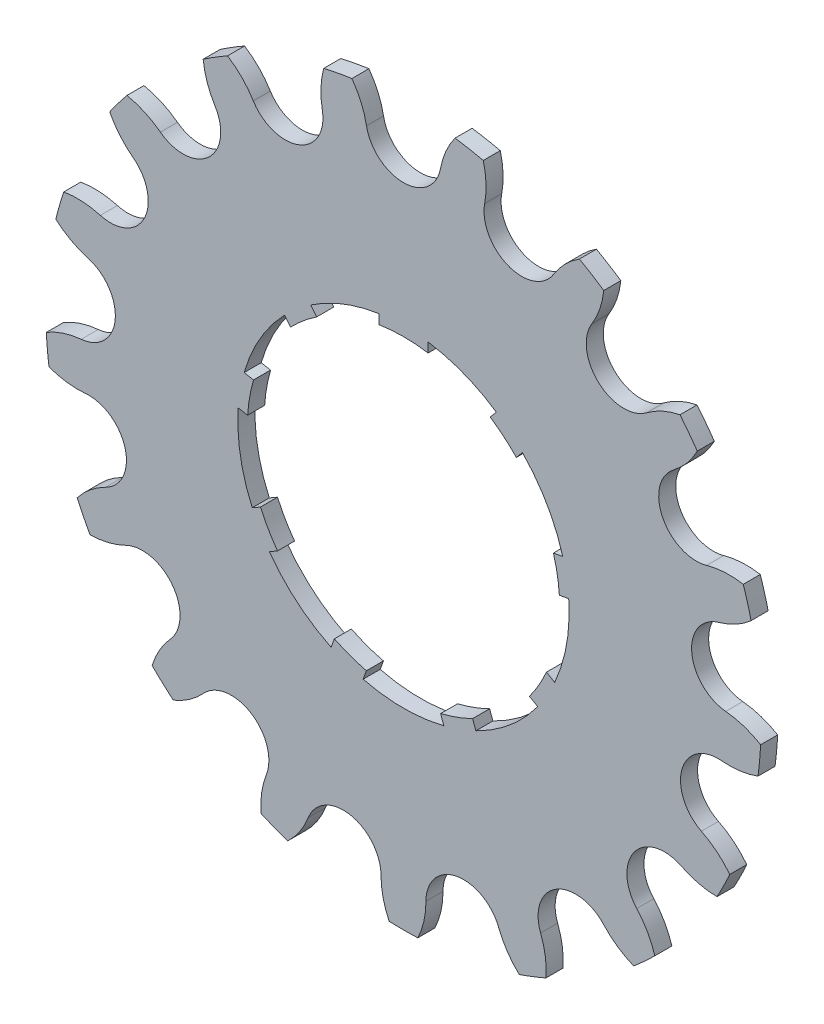
from build123d import *

# Parameters (mm, degrees)
SK_DISCO_R           = 37.77949966
DISCO_DEPTH          = 1.8
HUECO_DIENTE_DEPTH   = 54.458593221
MATRIZ_DIENTES_COUNT = 17


with BuildPart() as part:
    # Sk_Disco → Disco (new body)
    with BuildSketch(Plane.XY):
        Circle(SK_DISCO_R)
        with BuildLine():
            Line((2.6, 17.305779381), (2.6, 16.293863876))
            ThreePointArc((2.6, 16.293863876), (0, 16.5), (-2.6, 16.293863876))
            Line((-2.6, 16.293863876), (-2.6, 17.305779381))
            ThreePointArc((-2.6, 17.305779381), (-6.362648192, 16.302352836), (-9.810241185, 14.491693065))
            Line((-9.810241185, 14.491693065), (-9.163816615, 13.721314261))
            ThreePointArc((-9.163816615, 13.721314261), (-10.60599556, 12.639733311), (-11.92157661, 11.407278866))
            Line((-11.92157661, 11.407278866), (-12.56800118, 12.17765767))
            ThreePointArc((-12.56800118, 12.17765767), (-15.155444566, 8.75), (-16.830161491, 4.795379462))
            Line((-16.830161491, 4.795379462), (-15.839781591, 4.620748764))
            ThreePointArc((-15.839781591, 4.620748764), (-16.249327925, 2.865194932), (-16.464915031, 1.075440854))
            Line((-16.464915031, 1.075440854), (-17.455294931, 1.250071551))
            ThreePointArc((-17.455294931, 1.250071551), (-17.234135678, -3.038843109), (-15.975062189, -7.144745486))
            Line((-15.975062189, -7.144745486), (-15.104136721, -6.641916433))
            ThreePointArc((-15.104136721, -6.641916433), (-14.289419162, -8.25), (-13.304136721, -9.759607887))
            Line((-13.304136721, -9.759607887), (-14.175062189, -10.26243694))
            ThreePointArc((-14.175062189, -10.26243694), (-11.24878317, -13.405777755), (-7.645053746, -15.741764616))
            Line((-7.645053746, -15.741764616), (-7.301098416, -14.796755115))
            ThreePointArc((-7.301098416, -14.796755115), (-5.643332365, -15.504928243), (-3.918204981, -16.028027631))
            Line((-3.918204981, -16.028027631), (-4.262160311, -16.973037132))
            ThreePointArc((-4.262160311, -16.973037132), (0, -17.5), (4.262160311, -16.973037132))
            Line((4.262160311, -16.973037132), (3.918204981, -16.028027631))
            ThreePointArc((3.918204981, -16.028027631), (5.643332365, -15.504928243), (7.301098416, -14.796755115))
            Line((7.301098416, -14.796755115), (7.645053746, -15.741764616))
            ThreePointArc((7.645053746, -15.741764616), (11.24878317, -13.405777755), (14.175062189, -10.26243694))
            Line((14.175062189, -10.26243694), (13.304136721, -9.759607887))
            ThreePointArc((13.304136721, -9.759607887), (14.289419162, -8.25), (15.104136721, -6.641916433))
            Line((15.104136721, -6.641916433), (15.975062189, -7.144745486))
            ThreePointArc((15.975062189, -7.144745486), (17.234135678, -3.038843109), (17.455294931, 1.250071551))
            Line((17.455294931, 1.250071551), (16.464915031, 1.075440854))
            ThreePointArc((16.464915031, 1.075440854), (16.249327925, 2.865194932), (15.839781591, 4.620748764))
            Line((15.839781591, 4.620748764), (16.830161491, 4.795379462))
            ThreePointArc((16.830161491, 4.795379462), (15.155444566, 8.75), (12.56800118, 12.17765767))
            Line((12.56800118, 12.17765767), (11.92157661, 11.407278866))
            ThreePointArc((11.92157661, 11.407278866), (10.60599556, 12.639733311), (9.163816615, 13.721314261))
            Line((9.163816615, 13.721314261), (9.810241185, 14.491693065))
            ThreePointArc((9.810241185, 14.491693065), (6.362648192, 16.302352836), (2.6, 17.305779381))
        make_face(mode=Mode.SUBTRACT)
    extrude(amount=DISCO_DEPTH)

    # Sk_Hueco → Hueco_diente (cut, through all)
    with BuildSketch(Plane.XY):
        with BuildLine():
            ThreePointArc((-3.907318071, 33.82750948), (0, 30.582913814), (3.907318071, 33.82750948))
            ThreePointArc((3.907318071, 33.82750948), (5.04150125, 36.778242018), (7.15264743, 39.131166964))
            ThreePointArc((7.15264743, 39.131166964), (0, 39.77949966), (-7.15264743, 39.131166964))
            ThreePointArc((-7.15264743, 39.131166964), (-5.04150125, 36.778242018), (-3.907318071, 33.82750948))
        make_face()
    hueco_diente = extrude(amount=HUECO_DIENTE_DEPTH, mode=Mode.SUBTRACT)

    # Matriz_dientes: Hueco_diente ×17 about axis
    matriz_dientes_axis = Axis((0, 0, -0.09), (0, 0, 1))
    for i in range(1, MATRIZ_DIENTES_COUNT):
        add(hueco_diente.rotate(matriz_dientes_axis, i * 360 / MATRIZ_DIENTES_COUNT), mode=Mode.SUBTRACT)


solid = part.part
